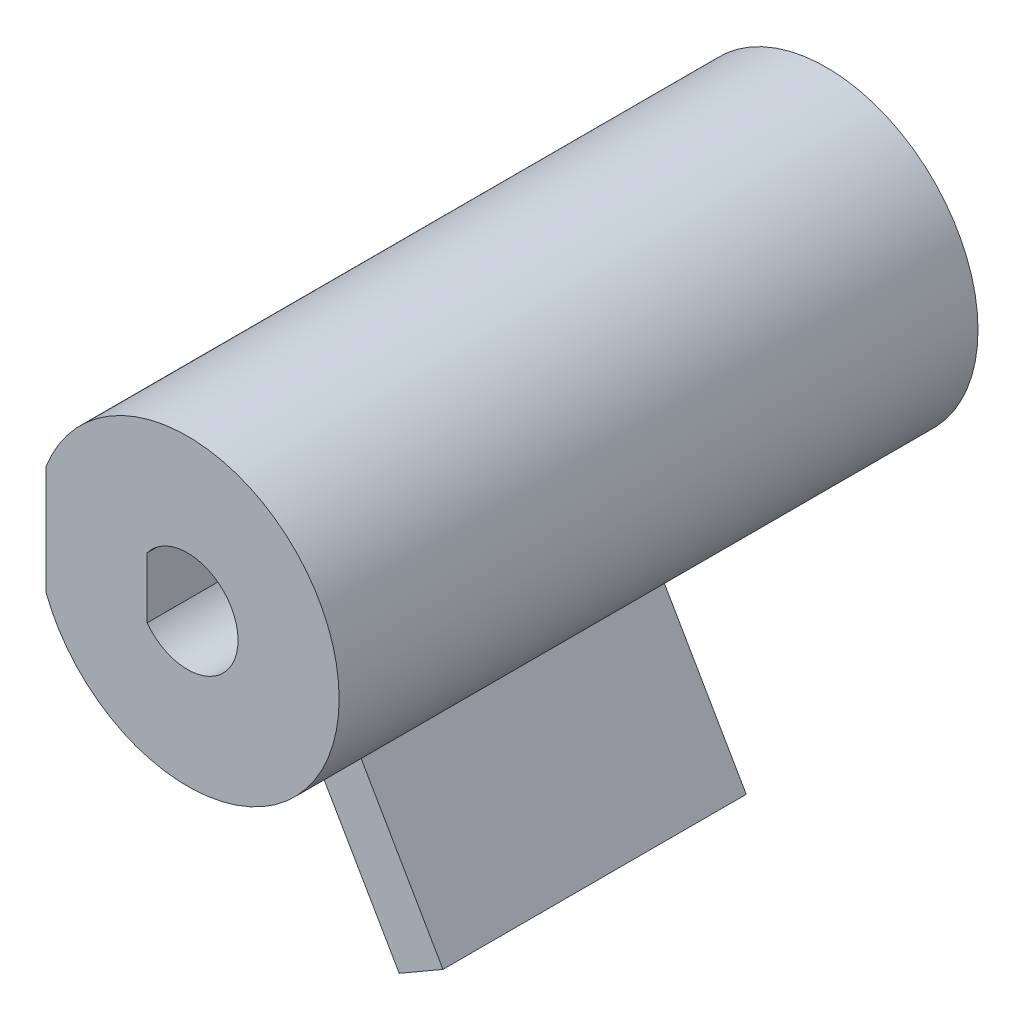
from build123d import *

# Parameters (mm, degrees)
EXTRUDE_1_DEPTH = 63.2
EXTRUDE_START   = -31.6
EXTRUDE_4_DEPTH = 15


with BuildPart() as part:
    # 草图1 → 拉伸-薄壁1 (new body)
    with BuildSketch(Plane.XY):
        with BuildLine():
            Line((-14, 5.385164807), (-14, -5.385164807))
            ThreePointArc((-14, -5.385164807), (15, 0), (-14, 5.385164807))
        make_face()
        with BuildLine():
            Line((-4, 3), (-4, -3))
            ThreePointArc((-4, -3), (5, 0), (-4, 3))
        make_face(mode=Mode.SUBTRACT)
    extrude(amount=EXTRUDE_1_DEPTH)

    # 草图9 → 拉伸-薄壁4 (add, symmetric)
    with BuildSketch(Plane.XY.offset(63.2).offset(EXTRUDE_START)):
        Polygon((-14, -5.385164807), (4.341640192, -37.153817513), (8.671767211, -34.653817513), (-9.669872981, -2.885164807), align=None)
    extrude(amount=EXTRUDE_4_DEPTH, both=True)


solid = part.part
